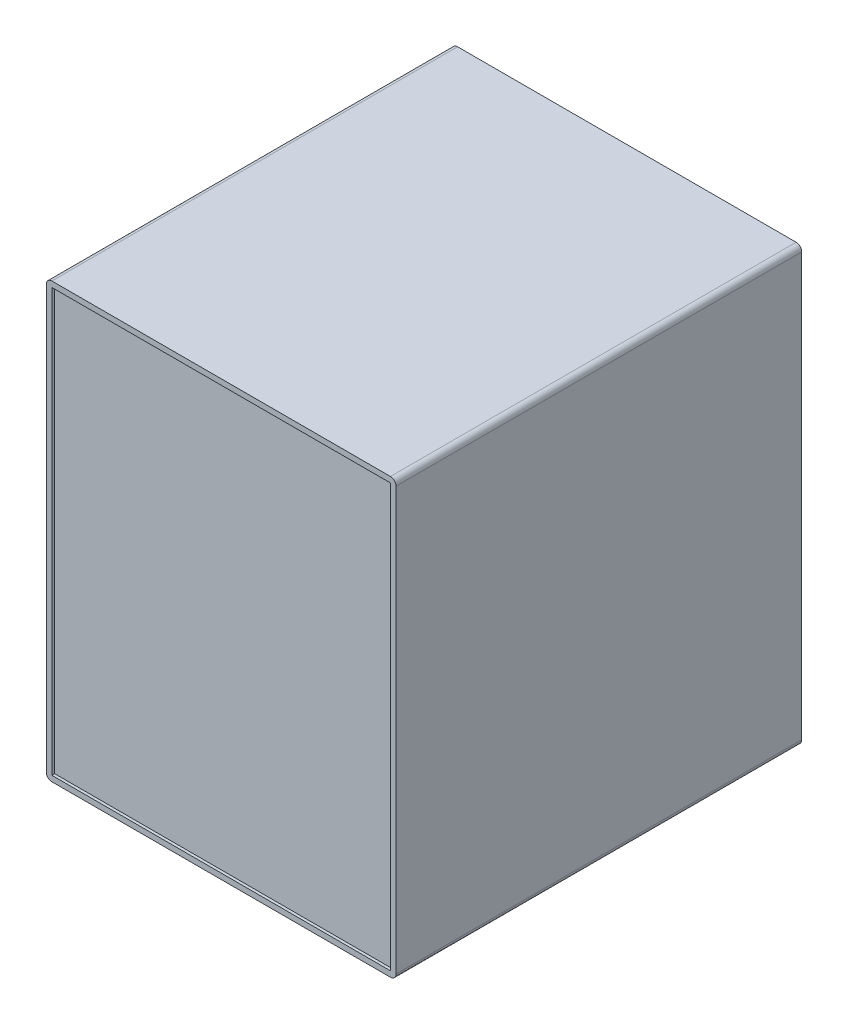
from build123d import *

# Parameters (mm, degrees)
SKETCH1_W                  = 125
SKETCH1_H                  = 155
BOSS_EXTRUDE1_DEPTH        = 145
SKETCH2_W                  = 121
SKETCH2_H                  = 151
CUT_EXTRUDE1_DEPTH         = 1
FILLET1_R                  = 2
FILLET2_R                  = 2
F_10_0MM_DOWEL_HOLE1_D     = 10
F_10_0MM_DOWEL_HOLE1_DEPTH = 20
F_10_0MM_DOWEL_HOLE1_TIP   = 3.004303095


with BuildPart() as part:
    # Sketch1 → Boss-Extrude1 (new body)
    with BuildSketch(Plane.XY):
        with Locations((62.5, 77.5)):
            Rectangle(SKETCH1_W, SKETCH1_H)
    extrude(amount=BOSS_EXTRUDE1_DEPTH)

    # Sketch2 → Cut-Extrude1 (cut)
    with BuildSketch(Plane.XY.offset(145)):
        with Locations((62.5, 77.5)):
            Rectangle(SKETCH2_W, SKETCH2_H)
    extrude(amount=-CUT_EXTRUDE1_DEPTH, mode=Mode.SUBTRACT)

    # Fillet1
    fillet1_edges = [part.edges().sort_by_distance(p)[0] for p in [
        (0, 155, 72.5),
        (125, 155, 72.5),
        (0, 0, 72.5),
    ]]
    fillet(fillet1_edges, radius=FILLET1_R)

    # Fillet2
    fillet2_edges = [part.edges().sort_by_distance(p)[0] for p in [
        (125, 0, 72.5),
    ]]
    fillet(fillet2_edges, radius=FILLET2_R)

    # Ø10.0mm Dowel Hole1
    with Locations(Plane(origin=(62.532008196, 0, 72.5), x_dir=(0, 0, -1), z_dir=(0, -1, 0))):
        with Locations((0, 0)):
            Hole(F_10_0MM_DOWEL_HOLE1_D / 2, depth=F_10_0MM_DOWEL_HOLE1_DEPTH)
            with Locations((0, 0, -(F_10_0MM_DOWEL_HOLE1_DEPTH + F_10_0MM_DOWEL_HOLE1_TIP / 2))):  # 118° drill point
                Cone(0, F_10_0MM_DOWEL_HOLE1_D / 2, F_10_0MM_DOWEL_HOLE1_TIP, mode=Mode.SUBTRACT)


solid = part.part
